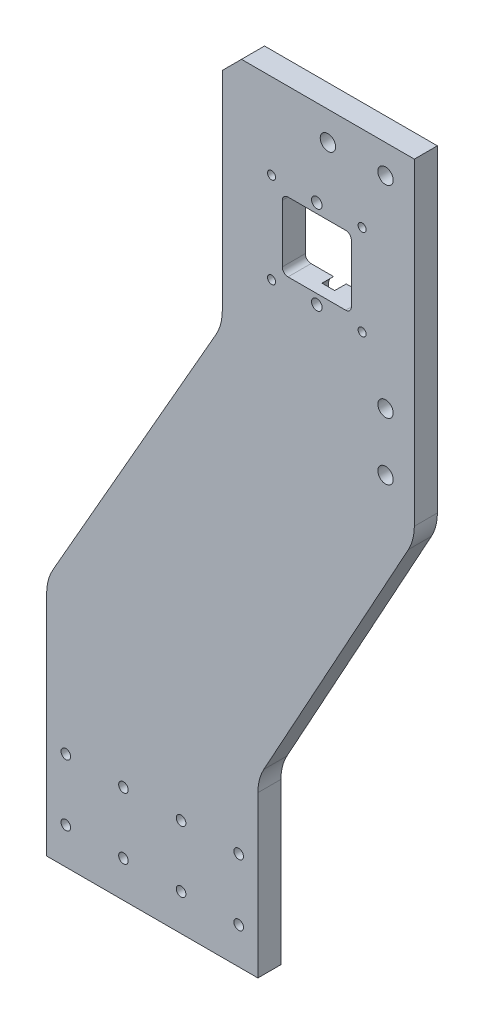
from build123d import *

# Parameters (mm, degrees)
ESQUISSE1_R             = 2.5
ESQUISSE1_R_2           = 2.1
ESQUISSE1_R_3           = 4
ESQUISSE1_R_4           = 2.75
BOSS_EXTRU_1_DEPTH      = 12
ESQUISSE2_R             = 4.5
ENL_V_MAT_EXTRU_1_DEPTH = 5
ENL_V_MAT_EXTRU_2_DEPTH = 1
ESQUISSE4_R             = 6
ENL_V_MAT_EXTRU_5_DEPTH = 6
ESQUISSE6_R             = 2.5
ENL_V_MAT_EXTRU_6_DEPTH = 10


with BuildPart() as part:
    # Esquisse1 → Boss.-Extru.1 (new body)
    with BuildSketch(Plane.XY):
        with BuildLine():
            Line((0, 0), (110, 0))
            Line((110, 0), (110, 83.574198108))
            ThreePointArc((110, 83.574198108), (110.787029848, 89.797708085), (113.098566114, 95.629371012))
            Line((113.098566114, 95.629371012), (188.36484852, 232.370628988))
            ThreePointArc((188.36484852, 232.370628988), (190.676384786, 238.202291915), (191.463414634, 244.425801892))
            Line((191.463414634, 244.425801892), (191.463414634, 410))
            Line((191.463414634, 410), (101.463414634, 410))
            Line((101.463414634, 410), (91.463414634, 400))
            Line((91.463414634, 400), (91.463414634, 291.641307553))
            ThreePointArc((91.463414634, 291.641307553), (90.625379122, 285.222626063), (88.167456868, 279.234271215))
            Line((88.167456868, 279.234271215), (3.295957766, 130.765728785))
            ThreePointArc((3.295957766, 130.765728785), (0.838035512, 124.777373937), (0, 118.358692447))
            Line((0, 118.358692447), (0, 0))
        make_face()
        with Locations((40, 51)):
            Circle(ESQUISSE1_R, mode=Mode.SUBTRACT)
        with Locations((40, 19)):
            Circle(ESQUISSE1_R, mode=Mode.SUBTRACT)
        with Locations((164.263414634, 318.43)):
            Circle(ESQUISSE1_R_2, mode=Mode.SUBTRACT)
        with Locations(Location((117.123414634, 318.43, 0), (0, 0, 180))):
            Circle(ESQUISSE1_R_2, mode=Mode.SUBTRACT)
        with Locations(Location((164.263414634, 365.57, 0), (0, 0, 180))):
            Circle(ESQUISSE1_R_2, mode=Mode.SUBTRACT)
        with Locations((117.123414634, 365.57)):
            Circle(ESQUISSE1_R_2, mode=Mode.SUBTRACT)
        with Locations((10, 51)):
            Circle(ESQUISSE1_R, mode=Mode.SUBTRACT)
        with Locations((10, 19)):
            Circle(ESQUISSE1_R, mode=Mode.SUBTRACT)
        with Locations(Location((100, 51, 0), (0, 0, 180))):
            Circle(ESQUISSE1_R, mode=Mode.SUBTRACT)
        with Locations(Location((100, 19, 0), (0, 0, 180))):
            Circle(ESQUISSE1_R, mode=Mode.SUBTRACT)
        with Locations(Location((70, 19, 0), (0, 0, 180))):
            Circle(ESQUISSE1_R, mode=Mode.SUBTRACT)
        with Locations(Location((70, 51, 0), (0, 0, 180))):
            Circle(ESQUISSE1_R, mode=Mode.SUBTRACT)
        with Locations((176.463414634, 395)):
            Circle(ESQUISSE1_R_3, mode=Mode.SUBTRACT)
        with Locations((146.463414634, 395)):
            Circle(ESQUISSE1_R_3, mode=Mode.SUBTRACT)
        with Locations((176.463414634, 290)):
            Circle(ESQUISSE1_R_3, mode=Mode.SUBTRACT)
        with Locations((176.463414634, 260)):
            Circle(ESQUISSE1_R_3, mode=Mode.SUBTRACT)
        with Locations((140.693414634, 319)):
            Circle(ESQUISSE1_R_4, mode=Mode.SUBTRACT)
        with Locations(Location((140.693414634, 365, 0), (0, 0, 180))):
            Circle(ESQUISSE1_R_4, mode=Mode.SUBTRACT)
        with BuildLine():
            Line((155.693414634, 360), (125.693414634, 360))
            ThreePointArc((125.693414634, 360), (123.572094291, 359.121320344), (122.693414634, 357))
            Line((122.693414634, 357), (122.693414634, 327))
            ThreePointArc((122.693414634, 327), (123.572094291, 324.878679656), (125.693414634, 324))
            Line((125.693414634, 324), (155.693414634, 324))
            ThreePointArc((155.693414634, 324), (157.814734978, 324.878679656), (158.693414634, 327))
            Line((158.693414634, 327), (158.693414634, 357))
            ThreePointArc((158.693414634, 357), (157.814734978, 359.121320344), (155.693414634, 360))
        make_face(mode=Mode.SUBTRACT)
    extrude(amount=BOSS_EXTRU_1_DEPTH)

    # Esquisse2 → Enlèv. mat.-Extru.1 (cut)
    with BuildSketch(Plane(origin=(0, 0, 0), x_dir=(-1, 0, 0), z_dir=(0, 0, -1))):
        with Locations((-100, 51)):
            Circle(ESQUISSE2_R)
        with Locations((-70, 51)):
            Circle(ESQUISSE2_R)
        with Locations((-40, 51)):
            Circle(ESQUISSE2_R)
        with Locations((-10, 51)):
            Circle(ESQUISSE2_R)
        with Locations((-70, 19)):
            Circle(ESQUISSE2_R)
        with Locations((-40, 19)):
            Circle(ESQUISSE2_R)
        with Locations((-10, 19)):
            Circle(ESQUISSE2_R)
        with Locations((-100, 19)):
            Circle(ESQUISSE2_R)
    extrude(amount=-ENL_V_MAT_EXTRU_1_DEPTH, mode=Mode.SUBTRACT)

    # Esquisse3 → Enlèv. mat.-Extru.2 (cut)
    # profile 1 of 6: a face of its own
    with BuildSketch(Plane(origin=(0, 0, 0), x_dir=(-1, 0, 0), z_dir=(0, 0, -1))):
        with BuildLine():
            Line((-99.430800832, 74.070105724), (-99.906161409, 73.615077679))
            add(Edge.make_bspline(
                [(-99.906161409, 73.615077679), (-99.943796535, 73.652757899), (-100.017642867, 73.726692711), (-100.138409304, 73.82292395), (-100.263486681, 73.904739528), (-100.393286678, 73.972014018), (-100.527990107, 74.024197962), (-100.667331141, 74.061526807), (-100.811536469, 74.083667177), (-100.90915704, 74.086766754), (-100.958545223, 74.088334891)],
                knots=[0, 0, 0, 0, 1.075575784, 2.110457258, 3.113929901, 4.09197124, 5.059417775, 6.02750972, 7.002078037, 8, 8, 8, 8], degree=3))
            add(Edge.make_bspline(
                [(-100.958545223, 74.088334891), (-101.001363268, 74.087236104), (-101.085440252, 74.08507854), (-101.208983284, 74.068694148), (-101.327036218, 74.041324757), (-101.440156785, 74.003409035), (-101.547654347, 73.954068698), (-101.650151762, 73.894065256), (-101.747018261, 73.822939676), (-101.837491091, 73.742040254), (-101.919866894, 73.653714418), (-101.99178532, 73.559174541), (-102.053044368, 73.460182767), (-102.103473058, 73.356232638), (-102.141843808, 73.247483697), (-102.169235501, 73.134014891), (-102.186622416, 73.016155976), (-102.188675291, 72.935751403), (-102.189715095, 72.895025596)],
                knots=[0, 0, 0, 0, 1.075001177, 2.110859044, 3.123021556, 4.114053297, 5.101481495, 6.087880186, 7.091499647, 8.114004866, 9.131394192, 10.11971144, 11.092043119, 12.050101265, 13.015322563, 13.981809771, 14.977764287, 16, 16, 16, 16], degree=3))
            add(Edge.make_bspline(
                [(-102.189715095, 72.895025596), (-102.188745215, 72.852890214), (-102.18683442, 72.769877744), (-102.168479071, 72.648053375), (-102.140199496, 72.530849553), (-102.098805738, 72.419135904), (-102.047862557, 72.311382106), (-101.983258212, 72.209675454), (-101.90792308, 72.112462774), (-101.821991774, 72.021436596), (-101.728520706, 71.937532367), (-101.627288497, 71.865154419), (-101.521375253, 71.802707873), (-101.409071529, 71.753252228), (-101.292326585, 71.713544762), (-101.169956292, 71.685547591), (-101.042236199, 71.668371424), (-100.955093931, 71.666306118), (-100.910868941, 71.665257968)],
                knots=[0, 0, 0, 0, 1.022067601, 2.013613092, 2.983553406, 3.943623673, 4.90013463, 5.87121881, 6.861774014, 7.881098904, 8.905697761, 9.905387765, 10.89678721, 11.884561068, 12.87834324, 13.885584958, 14.926927371, 16, 16, 16, 16], degree=3))
            add(Edge.make_bspline(
                [(-100.910868941, 71.665257968), (-100.882102223, 71.665517525), (-100.825626755, 71.666027093), (-100.742786868, 71.674298821), (-100.663446153, 71.686124217), (-100.587297346, 71.701779638), (-100.515109346, 71.723934868), (-100.44588266, 71.749842681), (-100.380022895, 71.780419065), (-100.317887137, 71.816718965), (-100.258550625, 71.857406715), (-100.20256876, 71.903962153), (-100.148959555, 71.955335626), (-100.098349426, 72.012154732), (-100.051594965, 72.074927503), (-100.007198276, 72.142500405), (-99.965667696, 72.215544057), (-99.941128371, 72.267123785), (-99.928597306, 72.293463096)],
                knots=[0, 0, 0, 0, 1.109579412, 2.178351274, 3.208885622, 4.204702371, 5.174744997, 6.119429583, 7.05542196, 7.97267548, 8.893247984, 9.828544973, 10.778894627, 11.756245826, 12.760884819, 13.796418446, 14.874735809, 16, 16, 16, 16], degree=3))
            Line((-99.928597306, 72.293463096), (-100.933304839, 72.293463096))
            Line((-100.933304839, 72.293463096), (-100.933304839, 72.921668224))
            Line((-100.933304839, 72.921668224), (-99.188212691, 72.921668224))
            Line((-99.188212691, 72.921668224), (-99.183304839, 72.772329282))
            add(Edge.make_bspline(
                [(-99.183304839, 72.772329282), (-99.183935461, 72.733975252), (-99.185195581, 72.657335639), (-99.196711753, 72.543232312), (-99.215788116, 72.430642328), (-99.241867331, 72.319678771), (-99.274551185, 72.209797324), (-99.316233329, 72.102050195), (-99.365042866, 71.995706677), (-99.419730489, 71.891218648), (-99.481183642, 71.790959544), (-99.547346984, 71.696027407), (-99.617277313, 71.606586545), (-99.692495584, 71.523883092), (-99.771830524, 71.447222304), (-99.855438305, 71.376899104), (-99.943614644, 71.312853989), (-100.035892436, 71.254545924), (-100.132797291, 71.203442346), (-100.233796426, 71.158989012), (-100.338737347, 71.121235735), (-100.447890987, 71.09028626), (-100.561042559, 71.066406278), (-100.678194485, 71.050031743), (-100.799411109, 71.038905062), (-100.88162978, 71.037677711), (-100.923489133, 71.037052839)],
                knots=[0, 0, 0, 0, 1.006889344, 2.011981806, 3.007738725, 4.003571281, 5.003404394, 6.015442001, 7.03424805, 8.074616296, 9.110249922, 10.119753985, 11.111721717, 12.089233633, 13.052717867, 14.006597561, 14.955430184, 15.912305663, 16.870361111, 17.829300583, 18.807640451, 19.796414044, 20.806216501, 21.841577364, 22.90109906, 24, 24, 24, 24], degree=3))
            add(Edge.make_bspline(
                [(-100.923489133, 71.037052839), (-100.968150225, 71.037669912), (-101.05668183, 71.038893134), (-101.187587673, 71.050349437), (-101.314695856, 71.069257327), (-101.438038083, 71.095425201), (-101.557900729, 71.12799321), (-101.674077852, 71.168873765), (-101.786331839, 71.217502478), (-101.894998838, 71.272591642), (-101.998689965, 71.335067552), (-102.097172833, 71.403834687), (-102.189909903, 71.479335393), (-102.27785109, 71.560305773), (-102.358941749, 71.648736086), (-102.436203811, 71.741759876), (-102.505894193, 71.842788886), (-102.571009376, 71.948547725), (-102.628858225, 72.058992074), (-102.679447875, 72.172079209), (-102.7225907, 72.287154354), (-102.75660986, 72.404753338), (-102.784230232, 72.524056162), (-102.803993126, 72.645581647), (-102.815154156, 72.769314579), (-102.816994108, 72.85246952), (-102.817920223, 72.894324474)],
                knots=[0, 0, 0, 0, 1.084149091, 2.14910686, 3.187506334, 4.202448172, 5.208724393, 6.201130722, 7.189831603, 8.176984443, 9.156919086, 10.126598231, 11.090766514, 12.05840148, 13.026036446, 14.001772938, 14.991905635, 16.003017641, 17.015720547, 18.016462227, 19.009322657, 19.99686681, 20.986544154, 21.980959929, 22.983742515, 24, 24, 24, 24], degree=3))
            add(Edge.make_bspline(
                [(-102.817920223, 72.894324474), (-102.816679957, 72.951423576), (-102.814230798, 73.064177374), (-102.791547873, 73.230264434), (-102.756188572, 73.390937093), (-102.705444415, 73.545610191), (-102.640327679, 73.694496792), (-102.561760801, 73.837946415), (-102.468037139, 73.975806586), (-102.395488587, 74.061161179), (-102.358685447, 74.104460692)],
                knots=[0, 0, 0, 0, 1.034044851, 2.041932006, 3.031217818, 4.011390712, 4.986069675, 5.97149666, 6.970960976, 8, 8, 8, 8], degree=3))
            add(Edge.make_bspline(
                [(-102.358685447, 74.104460692), (-102.335834738, 74.129510773), (-102.290476423, 74.179234806), (-102.217971239, 74.248327362), (-102.143627303, 74.313276921), (-102.06641494, 74.372706268), (-101.986740041, 74.42791634), (-101.904373288, 74.47787218), (-101.819746757, 74.524164409), (-101.732200464, 74.56442917), (-101.642192727, 74.600529887), (-101.549324914, 74.63107617), (-101.454292587, 74.658132916), (-101.356254231, 74.67871616), (-101.256200267, 74.695856315), (-101.15342048, 74.707344544), (-101.04819495, 74.715764599), (-100.977025694, 74.716279501), (-100.941017178, 74.716540019)],
                knots=[0, 0, 0, 0, 1.020590567, 2.025856924, 3.013483481, 3.991664875, 4.957826714, 5.930500614, 6.890802512, 7.860442893, 8.829981142, 9.809047939, 10.802672283, 11.803273349, 12.823572789, 13.857849586, 14.916166035, 16, 16, 16, 16], degree=3))
            add(Edge.make_bspline(
                [(-100.941017178, 74.716540019), (-100.903376588, 74.715959536), (-100.828485636, 74.714804589), (-100.717135192, 74.706813107), (-100.607332037, 74.694484135), (-100.499538892, 74.675989972), (-100.393394004, 74.65318282), (-100.289446802, 74.623961214), (-100.187019161, 74.590760205), (-100.120339155, 74.564289908), (-100.087050832, 74.551075275)],
                knots=[0, 0, 0, 0, 1.03180557, 2.052914215, 3.058998889, 4.059601663, 5.049854447, 6.033765722, 7.018406786, 8, 8, 8, 8], degree=3))
            add(Edge.make_bspline(
                [(-100.087050832, 74.551075275), (-100.059042826, 74.538862576), (-100.002075317, 74.514022284), (-99.919194612, 74.468575803), (-99.836111407, 74.418193164), (-99.753722211, 74.36103226), (-99.672152564, 74.297200007), (-99.59055079, 74.227704627), (-99.509749911, 74.151735762), (-99.457458007, 74.097668126), (-99.430800832, 74.070105724)],
                knots=[0, 0, 0, 0, 0.894392155, 1.819168899, 2.76525314, 3.739198753, 4.75366411, 5.797420238, 6.877176959, 8, 8, 8, 8], degree=3))
        make_face()
    # profile 2 of 6: a face of its own
    with BuildSketch(Plane(origin=(0, 0, 0), x_dir=(-1, 0, 0), z_dir=(0, 0, -1))):
        Polygon((-97.477475512, 74.626796429), (-96.8948433, 74.626796429), (-95.481381762, 71.126796429), (-96.152355319, 71.126796429), (-96.424390576, 71.844745147), (-97.94933048, 71.844745147), (-98.221365736, 71.126796429), (-98.891638172, 71.126796429), align=None)
        Polygon((-97.186509967, 73.687994346), (-97.710949069, 72.472950275), (-96.662070864, 72.472950275), align=None, mode=Mode.SUBTRACT)
    # profile 3 of 6: a face of its own
    with BuildSketch(Plane(origin=(0, 0, 0), x_dir=(-1, 0, 0), z_dir=(0, 0, -1))):
        with BuildLine():
            Line((-94.965356121, 74.626796429), (-94.337150992, 74.626796429))
            Line((-94.337150992, 74.626796429), (-94.337150992, 72.349552839))
            add(Edge.make_bspline(
                [(-94.337150992, 72.349552839), (-94.337116834, 72.325943366), (-94.337050856, 72.280341911), (-94.333748005, 72.214918753), (-94.330725668, 72.154781173), (-94.325272515, 72.099995009), (-94.317216338, 72.050536824), (-94.30941533, 72.006088918), (-94.298857437, 71.967447078), (-94.282990612, 71.923462549), (-94.258545043, 71.874043527), (-94.218602339, 71.82253789), (-94.172511877, 71.775531519), (-94.117269803, 71.736405198), (-94.055182597, 71.70475553), (-93.986591401, 71.681306629), (-93.911592904, 71.668272153), (-93.859735557, 71.666282202), (-93.833044422, 71.665257968)],
                knots=[0, 0, 0, 0, 1.155499968, 2.231836252, 3.205919964, 4.102923608, 4.924856345, 5.658536265, 6.31071849, 6.882491295, 7.94666036, 8.992281882, 10.060072772, 11.158554251, 12.289267114, 13.461410017, 14.693379945, 16, 16, 16, 16], degree=3))
            add(Edge.make_bspline(
                [(-93.833044422, 71.665257968), (-93.804688384, 71.666085417), (-93.749398912, 71.667698804), (-93.669873807, 71.683535942), (-93.596193347, 71.70875409), (-93.529917598, 71.744746813), (-93.471112515, 71.7878904), (-93.421335244, 71.837087609), (-93.382051204, 71.892436564), (-93.356447329, 71.94350019), (-93.342072014, 71.990499811), (-93.331296999, 72.032492188), (-93.323397721, 72.082039037), (-93.316231237, 72.138366577), (-93.311924732, 72.202058252), (-93.307255029, 72.272601845), (-93.305543539, 72.350480035), (-93.305251829, 72.404708081), (-93.30509971, 72.432986333)],
                knots=[0, 0, 0, 0, 1.261321664, 2.459363699, 3.594844139, 4.716940403, 5.803436589, 6.833651888, 7.818396249, 8.814403945, 9.360733334, 10.004355033, 10.743453831, 11.592799886, 12.532235708, 13.585170094, 14.740740724, 16, 16, 16, 16], degree=3))
            Line((-93.30509971, 72.432986333), (-93.30509971, 74.626796429))
            Line((-93.30509971, 74.626796429), (-92.676894582, 74.626796429))
            Line((-92.676894582, 74.626796429), (-92.676894582, 72.538855724))
            add(Edge.make_bspline(
                [(-92.676894582, 72.538855724), (-92.67698182, 72.496554145), (-92.677149569, 72.415212334), (-92.679725697, 72.298318428), (-92.685209808, 72.191554596), (-92.689815828, 72.09488964), (-92.698730054, 72.008453786), (-92.708016587, 71.931877927), (-92.719853072, 71.865433431), (-92.73746505, 71.789794447), (-92.76785811, 71.702698927), (-92.816855707, 71.602412211), (-92.879054986, 71.504225442), (-92.952571424, 71.409218741), (-93.035578208, 71.320960577), (-93.126234899, 71.243481334), (-93.223101188, 71.177942249), (-93.327189258, 71.125945832), (-93.438410525, 71.085392546), (-93.55786544, 71.058142781), (-93.685472545, 71.039732497), (-93.773613184, 71.037963963), (-93.819021986, 71.037052839)],
                knots=[0, 0, 0, 0, 1.170808336, 2.251350247, 3.235597562, 4.129743112, 4.929140599, 5.639994148, 6.264258765, 6.79612947, 7.788252245, 8.809469599, 9.879094798, 10.999557536, 12.129761673, 13.226370002, 14.293821979, 15.358369427, 16.438775801, 17.562147481, 18.744053101, 20, 20, 20, 20], degree=3))
            add(Edge.make_bspline(
                [(-93.819021986, 71.037052839), (-93.849192497, 71.037561022), (-93.908718297, 71.038563655), (-93.996261429, 71.047404264), (-94.080889063, 71.060431996), (-94.162442183, 71.079438116), (-94.241203847, 71.103990474), (-94.317153128, 71.134212716), (-94.390007781, 71.169936267), (-94.459360121, 71.210832547), (-94.525124805, 71.255054834), (-94.585230331, 71.304077101), (-94.641745072, 71.354273966), (-94.693036341, 71.407757925), (-94.73948938, 71.46396749), (-94.781008519, 71.523030048), (-94.817532075, 71.584940355), (-94.849978778, 71.650814339), (-94.87774999, 71.724000137), (-94.901162164, 71.807100999), (-94.92161559, 71.901419446), (-94.93681537, 72.007167975), (-94.950595579, 72.123998049), (-94.959317692, 72.252214028), (-94.963880622, 72.391819592), (-94.96485186, 72.488605235), (-94.965356121, 72.538855724)],
                knots=[0, 0, 0, 0, 1.001158378, 1.975264943, 2.917723546, 3.841610987, 4.75185031, 5.653588123, 6.552117133, 7.442167995, 8.324307438, 9.179605724, 10.014504199, 10.831958861, 11.636465792, 12.43274043, 13.225645099, 14.020104002, 14.867201867, 15.819789774, 16.883317127, 18.068162734, 19.364263498, 20.787406516, 22.332041935, 24, 24, 24, 24], degree=3))
            Line((-94.965356121, 72.538855724), (-94.965356121, 74.626796429))
        make_face()
    # profile 4 of 6: a face of its own
    with BuildSketch(Plane(origin=(0, 0, 0), x_dir=(-1, 0, 0), z_dir=(0, 0, -1))):
        with BuildLine():
            Line((-88.728176633, 74.019624955), (-89.188813653, 73.579320468))
            add(Edge.make_bspline(
                [(-89.188813653, 73.579320468), (-89.227888637, 73.619724067), (-89.304214324, 73.698644955), (-89.427203729, 73.803129256), (-89.555108232, 73.890202784), (-89.685439707, 73.963535554), (-89.820542438, 74.019017022), (-89.95885427, 74.059447302), (-90.101258365, 74.084096115), (-90.19763198, 74.086916375), (-90.246105319, 74.088334891)],
                knots=[0, 0, 0, 0, 1.115251505, 2.178435587, 3.19620269, 4.182487026, 5.141301733, 6.088180966, 7.038406374, 8, 8, 8, 8], degree=3))
            add(Edge.make_bspline(
                [(-90.246105319, 74.088334891), (-90.286586449, 74.087214214), (-90.366471497, 74.085002682), (-90.483763682, 74.068789972), (-90.595959719, 74.041219553), (-90.703443672, 74.003222408), (-90.805899265, 73.954056119), (-90.90354131, 73.89375874), (-90.996129074, 73.822874842), (-91.082439526, 73.741771181), (-91.161393294, 73.653159337), (-91.231153976, 73.55861071), (-91.289589737, 73.458341907), (-91.337547015, 73.353368376), (-91.374903881, 73.243204247), (-91.401581377, 73.127923689), (-91.417010928, 73.007389409), (-91.419313892, 72.925451104), (-91.420484326, 72.883807647)],
                knots=[0, 0, 0, 0, 1.035432265, 2.043311493, 3.022114605, 3.98653278, 4.95457646, 5.923598177, 6.917315552, 7.932509744, 8.948865224, 9.949768934, 10.933144597, 11.912367597, 12.897413939, 13.903909035, 14.934704909, 16, 16, 16, 16], degree=3))
            add(Edge.make_bspline(
                [(-91.420484326, 72.883807647), (-91.42014702, 72.854579355), (-91.419482183, 72.796969791), (-91.412204372, 72.711749258), (-91.40048538, 72.629065193), (-91.383525094, 72.549042841), (-91.362316091, 72.471612855), (-91.3374331, 72.396107249), (-91.306217755, 72.323569341), (-91.271568251, 72.253156651), (-91.231271276, 72.186790476), (-91.187823704, 72.123504821), (-91.140711906, 72.063609904), (-91.089630735, 72.007350579), (-91.033861288, 71.955606053), (-90.974844999, 71.906820306), (-90.911586344, 71.862214611), (-90.845399367, 71.820669539), (-90.775712295, 71.784578981), (-90.7044159, 71.751887908), (-90.630429186, 71.725337896), (-90.554652984, 71.703936164), (-90.477358092, 71.685737188), (-90.397788495, 71.674531519), (-90.316633961, 71.666045597), (-90.261787118, 71.665521641), (-90.234186249, 71.665257968)],
                knots=[0, 0, 0, 0, 1.103660481, 2.175337485, 3.227646561, 4.255952547, 5.262355991, 6.258840057, 7.255597736, 8.242457506, 9.22035537, 10.185017736, 11.140346927, 12.096287581, 13.051739095, 14.01125915, 14.986044842, 15.97314143, 16.960198552, 17.947847494, 18.933482797, 19.925264591, 20.920966487, 21.929612487, 22.958107872, 24, 24, 24, 24], degree=3))
            add(Edge.make_bspline(
                [(-90.234186249, 71.665257968), (-90.187370432, 71.66661213), (-90.095389526, 71.669272705), (-89.96039432, 71.690078032), (-89.831757338, 71.724301618), (-89.728977004, 71.764717684), (-89.648451328, 71.804629074), (-89.587148321, 71.841545144), (-89.523756234, 71.882839822), (-89.459327955, 71.930071613), (-89.393138794, 71.982673717), (-89.326357142, 72.041798218), (-89.257273377, 72.105498231), (-89.212017288, 72.150962181), (-89.188813653, 72.174272391)],
                knots=[0, 0, 0, 0, 1.404581149, 2.759636711, 4.088442092, 5.392261763, 6.066678138, 6.783632037, 7.538459478, 8.336747902, 9.180226004, 10.074962426, 11.012997595, 12, 12, 12, 12], degree=3))
            Line((-89.188813653, 72.174272391), (-88.742199069, 71.70522191))
            add(Edge.make_bspline(
                [(-88.742199069, 71.70522191), (-88.773593671, 71.674911408), (-88.834869218, 71.61575179), (-88.927301681, 71.531750654), (-89.019617814, 71.456266295), (-89.109587451, 71.386558961), (-89.19868439, 71.324659398), (-89.286899181, 71.270505784), (-89.373233194, 71.222728497), (-89.459479184, 71.182133278), (-89.546173817, 71.14766372), (-89.635372406, 71.117987694), (-89.72734764, 71.092882843), (-89.822661261, 71.072626525), (-89.920424243, 71.056383693), (-90.021551516, 71.045419876), (-90.125401885, 71.038049266), (-90.195845199, 71.037386955), (-90.231381762, 71.037052839)],
                knots=[0, 0, 0, 0, 1.244526981, 2.429050516, 3.560637417, 4.644440555, 5.67424972, 6.652764056, 7.595344123, 8.486817594, 9.369275933, 10.254498637, 11.166417451, 12.086725134, 13.032340136, 13.991389299, 14.986715468, 16, 16, 16, 16], degree=3))
            add(Edge.make_bspline(
                [(-90.231381762, 71.037052839), (-90.296658026, 71.038716862), (-90.424385529, 71.04197289), (-90.611566856, 71.066097859), (-90.789384092, 71.106542945), (-90.958269833, 71.163743451), (-91.118170377, 71.236814417), (-91.269044817, 71.32639599), (-91.410649977, 71.432250166), (-91.541841966, 71.553136232), (-91.660511364, 71.686644743), (-91.765401369, 71.829996258), (-91.852166385, 71.983895295), (-91.924209248, 72.146068275), (-91.980545819, 72.317255257), (-92.020197214, 72.497641412), (-92.04464994, 72.687052566), (-92.047325103, 72.81642475), (-92.048689454, 72.882405404)],
                knots=[0, 0, 0, 0, 1.078019885, 2.10938526, 3.111377082, 4.085535484, 5.04941344, 6.010039228, 6.978205633, 7.964457913, 8.951525778, 9.924444315, 10.892603023, 11.863865945, 12.85144698, 13.863884204, 14.910567087, 16, 16, 16, 16], degree=3))
            add(Edge.make_bspline(
                [(-92.048689454, 72.882405404), (-92.048112946, 72.925437423), (-92.046970447, 73.010716367), (-92.034962679, 73.136339162), (-92.018223153, 73.258798916), (-91.991667418, 73.376824092), (-91.959657097, 73.492004706), (-91.919848058, 73.60308888), (-91.872303881, 73.710395881), (-91.818557027, 73.814105346), (-91.757753748, 73.913537869), (-91.689829811, 74.007839167), (-91.616533842, 74.097737228), (-91.536104659, 74.182039388), (-91.449711003, 74.261485836), (-91.356962817, 74.335646037), (-91.258417934, 74.405583532), (-91.153809631, 74.469494802), (-91.045170168, 74.527305943), (-90.933869774, 74.578297839), (-90.820181902, 74.620915321), (-90.704587234, 74.65626495), (-90.586597384, 74.682650948), (-90.467054534, 74.702624298), (-90.344941518, 74.713789528), (-90.262953206, 74.715617348), (-90.221566056, 74.716540019)],
                knots=[0, 0, 0, 0, 1.071919942, 2.124283339, 3.142214191, 4.149696895, 5.136002878, 6.119640489, 7.086990633, 8.058538607, 9.028339693, 9.988281803, 10.952401235, 11.916291999, 12.888973767, 13.874849856, 14.873389453, 15.898127285, 16.927174885, 17.938320013, 18.946391617, 19.950418109, 20.947802303, 21.956882652, 22.968648068, 24, 24, 24, 24], degree=3))
            add(Edge.make_bspline(
                [(-90.221566056, 74.716540019), (-90.186258574, 74.716011121), (-90.116010709, 74.714958824), (-90.01139985, 74.706186783), (-89.90762562, 74.692410383), (-89.805059562, 74.671624727), (-89.702968019, 74.646949528), (-89.602692588, 74.614640758), (-89.50265137, 74.578626546), (-89.404413364, 74.535578909), (-89.307841442, 74.488588524), (-89.215197955, 74.435276226), (-89.124927427, 74.378922794), (-89.039030199, 74.316192985), (-88.95589723, 74.249362126), (-88.87596323, 74.178118414), (-88.799929668, 74.101274006), (-88.752215225, 74.046978895), (-88.728176633, 74.019624955)],
                knots=[0, 0, 0, 0, 0.996412454, 1.982464992, 2.961075852, 3.949442424, 4.934965278, 5.923860011, 6.921385422, 7.934793307, 8.949617135, 9.951082467, 10.950285876, 11.951772932, 12.951063433, 13.960125323, 14.972308753, 16, 16, 16, 16], degree=3))
        make_face()
    # profile 5 of 6: a face of its own
    with BuildSketch(Plane(origin=(0, 0, 0), x_dir=(-1, 0, 0), z_dir=(0, 0, -1))):
        Polygon((-88.099971505, 74.626796429), (-87.471766377, 74.626796429), (-87.471766377, 73.280642583), (-86.260227915, 73.280642583), (-86.260227915, 74.626796429), (-85.632022787, 74.626796429), (-85.632022787, 71.126796429), (-86.260227915, 71.126796429), (-86.260227915, 72.652437455), (-87.471766377, 72.652437455), (-87.471766377, 71.126796429), (-88.099971505, 71.126796429), align=None)
    # profile 6 of 6: a face of its own
    with BuildSketch(Plane(origin=(0, 0, 0), x_dir=(-1, 0, 0), z_dir=(0, 0, -1))):
        Polygon((-84.82433048, 74.626796429), (-82.939715095, 74.626796429), (-82.939715095, 73.998591301), (-84.196125351, 73.998591301), (-84.196125351, 73.325514378), (-82.939715095, 73.325514378), (-82.939715095, 72.69730925), (-84.196125351, 72.69730925), (-84.196125351, 71.755001557), (-82.939715095, 71.755001557), (-82.939715095, 71.126796429), (-84.82433048, 71.126796429), align=None)
    extrude(amount=-ENL_V_MAT_EXTRU_2_DEPTH, mode=Mode.SUBTRACT)

    # Esquisse4 → Enlèv. mat.-Extru.5 (cut)
    with BuildSketch(Plane(origin=(0, 0, 0), x_dir=(-1, 0, 0), z_dir=(0, 0, -1))):
        with Locations((-140.693414634, 365)):
            Circle(ESQUISSE4_R)
        with Locations((-140.693414634, 319)):
            Circle(ESQUISSE4_R)
    extrude(amount=-ENL_V_MAT_EXTRU_5_DEPTH, mode=Mode.SUBTRACT)

    # Esquisse6 → Enlèv. mat.-Extru.6 (cut)
    with BuildSketch(Plane.XZ):
        with Locations(Location((15, 6, 0), (0, 0, 270))):
            Circle(ESQUISSE6_R)
        with Locations(Location((55, 6, 0), (0, 0, 270))):
            Circle(ESQUISSE6_R)
        with Locations(Location((95, 6, 0), (0, 0, 270))):
            Circle(ESQUISSE6_R)
    extrude(amount=-ENL_V_MAT_EXTRU_6_DEPTH, mode=Mode.SUBTRACT)


solid = part.part
